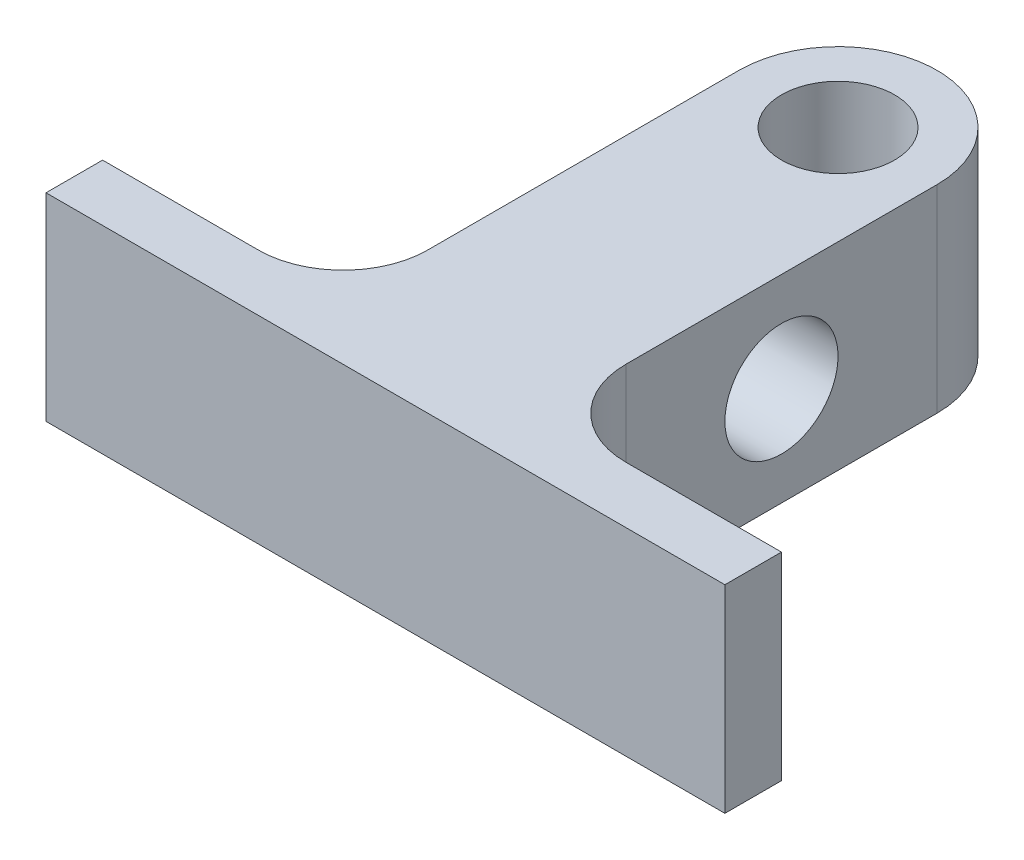
from build123d import *

# Parameters (mm, degrees)
SKETCH2_R           = 5
BOSS_EXTRUDE1_DEPTH = 17.5
SKETCH3_R           = 5
CUT_EXTRUDE1_DEPTH  = 52.326162919


with BuildPart() as part:
    # Sketch2 → Boss-Extrude1 (new body)
    with BuildSketch(Plane(origin=(0, 0, 0), x_dir=(1, 0, 0), z_dir=(0, 1, 0))):
        with BuildLine():
            Line((-8.75, -7.5), (-8.75, 20))
            ThreePointArc((-8.75, 20), (0, 28.75), (8.75, 20))
            Line((8.75, 20), (8.75, -7.5))
            ThreePointArc((8.75, -7.5), (10.946699141, -12.803300859), (16.25, -15))
            Line((16.25, -15), (30, -15))
            Line((30, -15), (30, -20))
            Line((30, -20), (-30, -20))
            Line((-30, -20), (-30, -15))
            Line((-30, -15), (-16.25, -15))
            ThreePointArc((-16.25, -15), (-10.946699141, -12.803300859), (-8.75, -7.5))
        make_face()
        with Locations(Location((0, 20, 0), (0, 0, 270))):
            Circle(SKETCH2_R, mode=Mode.SUBTRACT)
    extrude(amount=BOSS_EXTRUDE1_DEPTH)

    # Sketch3 → Cut-Extrude1 (cut, through all)
    with BuildSketch(Plane.ZY.offset(8.75)):
        with Locations((-6.25, 8.75)):
            Circle(SKETCH3_R)
    extrude(amount=-CUT_EXTRUDE1_DEPTH, mode=Mode.SUBTRACT)


solid = part.part
